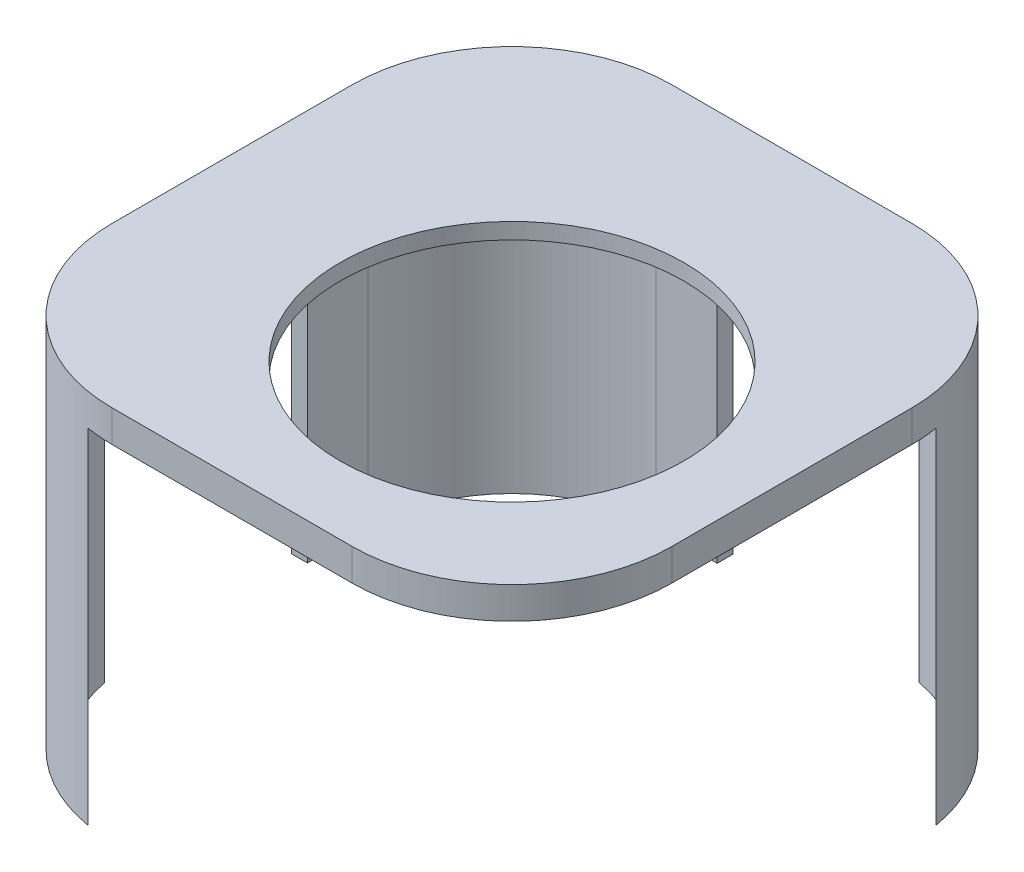
from build123d import *

# Parameters (mm, degrees)
SKETCH1_W           = 70
SKETCH1_H           = 70
BOSS_EXTRUDE1_DEPTH = 47
FILLET1_R           = 20
SHELL1_T            = -2
SKETCH2_R           = 21.5
CUT_EXTRUDE1_DEPTH  = 69.256867786
SKETCH6_W           = 75
SKETCH6_H           = 43.024157236
CUT_EXTRUDE4_DEPTH  = 69.256867786
SKETCH7_W           = 25.54869255
SKETCH7_H           = 28.800793666
CUT_EXTRUDE5_DEPTH  = 10
SKETCH9_W           = 25.672093796
SKETCH9_H           = 28.560455229
CUT_EXTRUDE6_DEPTH  = 10


with BuildPart() as part:
    # Sketch1 → Boss-Extrude1 (new body)
    with BuildSketch(Plane(origin=(0, 0, 0), x_dir=(1, 0, 0), z_dir=(0, 1, 0))):
        Rectangle(SKETCH1_W, SKETCH1_H)
    extrude(amount=BOSS_EXTRUDE1_DEPTH)

    # Fillet1
    fillet1_edges = [part.edges().sort_by_distance(p)[0] for p in [
        (35, 23.5, 35),
        (-35, 23.5, 35),
        (-35, 23.5, -35),
        (35, 23.5, -35),
    ]]
    fillet(fillet1_edges, radius=FILLET1_R)

    # Shell1
    shell1_openings = [part.faces().sort_by_distance(p)[0] for p in [
        (0, 0, 0),
    ]]
    offset(amount=SHELL1_T, openings=shell1_openings, kind=Kind.INTERSECTION)

    # Sketch2 → Cut-Extrude1 (cut, through all)
    with BuildSketch(Plane(origin=(0, 47, 0), x_dir=(1, 0, 0), z_dir=(0, 1, 0))):
        with Locations(Location((5, -5, 0), (0, 0, 270))):
            Circle(SKETCH2_R)
    extrude(amount=-CUT_EXTRUDE1_DEPTH, mode=Mode.SUBTRACT)

    # Sketch6 → Cut-Extrude4 (cut, through all)
    with BuildSketch(Plane(origin=(0, 0, 0), x_dir=(0.7071067811865477, 0, -0.7071067811865475), z_dir=(0.7071067811865475, 0, 0.7071067811865477))):
        with Locations((0, 21.512078618)):
            Rectangle(SKETCH6_W, SKETCH6_H)
    extrude(amount=CUT_EXTRUDE4_DEPTH, mode=Mode.SUBTRACT)

    # Sketch7 → Cut-Extrude5 (cut)
    with BuildSketch(Plane(origin=(0, 0, -35), x_dir=(-1, 0, 0), z_dir=(0, 0, -1))):
        with Locations((-5.439128437, 14.400396833)):
            Rectangle(SKETCH7_W, SKETCH7_H)
    extrude(amount=-CUT_EXTRUDE5_DEPTH, mode=Mode.SUBTRACT)

    # Sketch9 → Cut-Extrude6 (cut)
    with BuildSketch(Plane.ZY.offset(35)):
        with Locations((5.425785495, 14.280227615)):
            Rectangle(SKETCH9_W, SKETCH9_H)
    extrude(amount=-CUT_EXTRUDE6_DEPTH, mode=Mode.SUBTRACT)


solid = part.part
